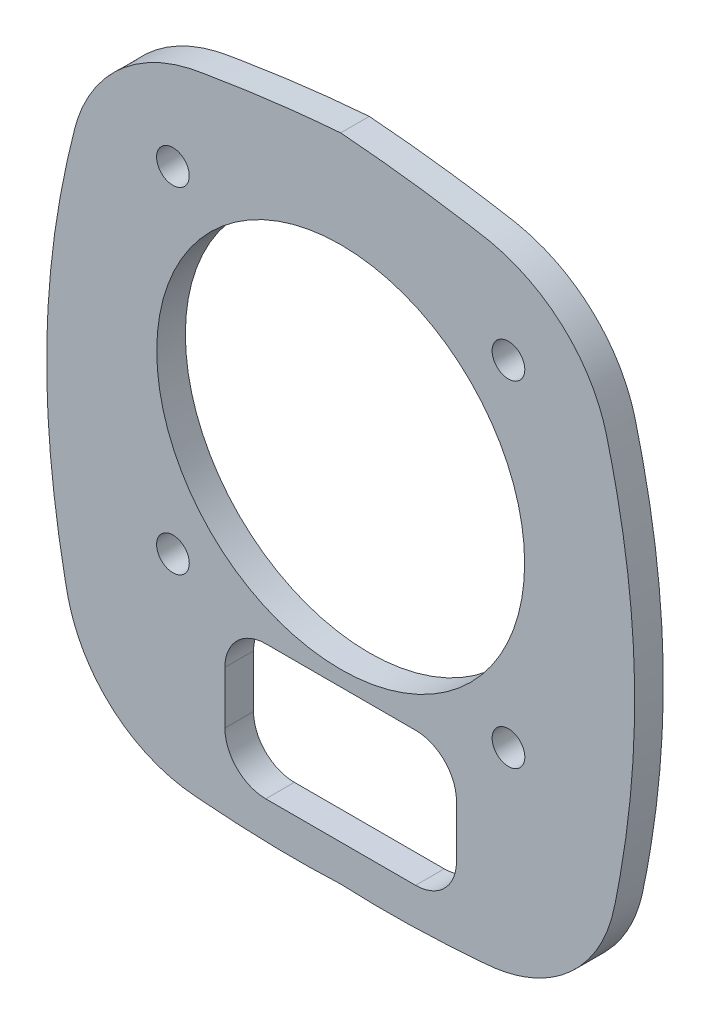
from build123d import *

# Parameters (mm, degrees)
SKETCH_1_R      = 1.6
SKETCH_1_R_2    = 18
EXTRUDE_1_DEPTH = 1.4


with BuildPart() as part:
    # Эскиз1 → Бобышка-Вытянуть1 (new, symmetric)
    with BuildSketch(Plane.XY):
        with BuildLine():
            add(Edge.make_bspline(
                [(0, 131.106222882), (-0.370220785, 131.076347993), (-1.102779578, 131.017234316), (-2.189060224, 130.919624595), (-3.443637711, 130.798467833), (-4.881735459, 130.646269922), (-6.503020503, 130.456312253), (-8.12495085, 130.247392322), (-9.741711108, 130.020630526), (-11.36281695, 129.775036484), (-12.676015392, 129.561961331), (-13.68967903, 129.390078582), (-14.413232864, 129.264584839), (-15.159625099, 129.094362093), (-15.928185443, 128.880405682), (-16.715163254, 128.616368934), (-17.516348702, 128.298628961), (-18.326688606, 127.922941878), (-19.728048414, 127.169724573), (-21.747987535, 125.727575964), (-23.567693799, 123.700004581), (-24.612712681, 122.011346521), (-25.101312847, 121.04901032), (-25.462593655, 120.225148914), (-25.738909462, 119.460763634), (-25.94677143, 118.767454031), (-26.081687876, 118.239687864), (-26.212908569, 117.717370422), (-26.550773375, 116.339124971), (-27.062440519, 114.066420204), (-27.653164131, 110.922560067), (-28.131235228, 107.713696234), (-28.475274231, 104.545836759), (-28.699132748, 101.293497056), (-28.820606115, 96.997365467), (-28.681457815, 92.743441744), (-28.310546102, 88.465729648), (-28.011412762, 86.039840672), (-27.687188607, 83.821524975), (-27.446887043, 82.351713486), (-27.170364704, 80.822297117), (-26.964445801, 79.763919621), (-26.795893016, 78.905610826), (-26.639789871, 78.227638137), (-26.496238435, 77.706670532), (-26.315714678, 77.126427714), (-26.080412167, 76.474242148), (-25.653035676, 75.47125893), (-25.021169521, 74.284763335), (-23.797814677, 72.515816398), (-22.274906789, 70.980648572), (-20.507858139, 69.748039699), (-19.073299489, 68.983497976), (-17.565682132, 68.396534243), (-16.374108839, 68.085794929), (-15.540656532, 67.931878814), (-15.058842612, 67.858658077), (-14.543170425, 67.797527545), (-13.993799753, 67.752137476), (-13.412264546, 67.704717217), (-12.688945313, 67.650229305), (-11.804304984, 67.589091763), (-10.73880925, 67.52411052), (-8.932087435, 67.42921281), (-6.950627599, 67.36001138), (-4.815403254, 67.335396808), (-3.186397421, 67.342670006), (-1.577573114, 67.374694658), (-0.508566905, 67.421110428), (0, 67.443192175)],
                knots=[0, 0, 0, 0, 0.010771191, 0.02131304, 0.031628454, 0.047322767, 0.063249599, 0.078966036, 0.094746057, 0.11059324, 0.126513589, 0.133325198, 0.140410134, 0.147805883, 0.155515432, 0.163537099, 0.171866609, 0.180497955, 0.189423614, 0.217985674, 0.251992716, 0.267592695, 0.275472244, 0.283274722, 0.293667804, 0.299018776, 0.304259573, 0.309463091, 0.314637016, 0.345411575, 0.377006574, 0.407382407, 0.439472665, 0.469388094, 0.50189901, 0.564078892, 0.592670464, 0.626403664, 0.634940925, 0.657684734, 0.669589076, 0.680011587, 0.688953116, 0.694953853, 0.700182096, 0.704619949, 0.712574345, 0.720275767, 0.736225015, 0.751452289, 0.78255157, 0.798227668, 0.813816479, 0.82957521, 0.845040558, 0.849440511, 0.854151769, 0.859170891, 0.864496245, 0.87013637, 0.876091626, 0.885531561, 0.8958518, 0.907047779, 0.937998223, 0.953339227, 0.968970642, 0.985238155, 1, 1, 1, 1], degree=3))
            add(Edge.make_bspline(
                [(0, 67.443192175), (0.249821364, 67.431628062), (0.762662013, 67.40788891), (1.552151885, 67.380688451), (2.38158192, 67.359162124), (3.492443713, 67.340799343), (4.860854811, 67.335584203), (7.017688253, 67.361429059), (9.206266825, 67.439481423), (11.360555129, 67.559242305), (12.742830846, 67.652471284), (13.828642073, 67.738350945), (14.670177097, 67.806690644), (15.433665488, 67.910835289), (16.43715099, 68.097635371), (17.7023193, 68.441566796), (19.19906457, 69.04219543), (20.619754867, 69.817813812), (22.370543972, 71.063544766), (23.879054895, 72.612317775), (25.087984722, 74.395533827), (25.708103716, 75.586617657), (26.125541169, 76.590715807), (26.381172043, 77.319435939), (26.610332418, 78.098259903), (26.771259587, 78.796324954), (26.904003327, 79.460947792), (27.019377268, 80.04101619), (27.141224488, 80.6773507), (27.269461333, 81.369952952), (27.48482909, 82.581967896), (27.69853251, 83.895434571), (28.020991969, 86.109477736), (28.322099842, 88.575755775), (28.688440492, 92.86238598), (28.82169129, 97.132197747), (28.691853506, 101.444329278), (28.461147635, 104.703501922), (28.11041252, 107.874360128), (27.625487332, 111.086050261), (27.027115418, 114.236733399), (26.490376549, 116.600816702), (26.103003987, 118.15804878), (25.921243346, 118.866835156), (25.677595437, 119.639466291), (25.110109967, 121.14785111), (23.832711812, 123.43277094), (21.622994104, 125.838661408), (19.585309988, 127.259620437), (18.176655717, 127.99690654), (17.365078488, 128.362625042), (16.563395265, 128.670990381), (15.776455467, 128.926042141), (15.008483475, 129.131941856), (14.262643492, 129.293613738), (13.540279292, 129.415036674), (12.534500053, 129.585694823), (11.23493113, 129.794831482), (9.103598592, 130.116248501), (6.966209264, 130.402556522), (4.828909424, 130.65214503), (3.228804537, 130.820700086), (1.621804658, 130.97375985), (0.54635647, 131.061598497), (0, 131.106222882)],
                knots=[0, 0, 0, 0, 0.007252899, 0.014888965, 0.022909471, 0.031315438, 0.047109596, 0.062593786, 0.093869192, 0.110611185, 0.125167253, 0.134046281, 0.142201111, 0.14964863, 0.156381348, 0.171795973, 0.187580878, 0.203048579, 0.21862316, 0.249784285, 0.265041537, 0.281007318, 0.288624024, 0.296566116, 0.30339124, 0.312158749, 0.317330326, 0.323047655, 0.329310904, 0.336120154, 0.34347537, 0.365011642, 0.37470932, 0.408363303, 0.437047062, 0.499467311, 0.532105703, 0.562131004, 0.594200646, 0.624600263, 0.656307776, 0.687187957, 0.694889722, 0.702849025, 0.708402608, 0.718376373, 0.749561686, 0.78361641, 0.812211035, 0.821107497, 0.829710036, 0.838011553, 0.846006084, 0.853689891, 0.861061349, 0.86812915, 0.874930843, 0.890648177, 0.906302189, 0.937440768, 0.953185002, 0.968706837, 0.984102235, 1, 1, 1, 1], degree=3))
        make_face()
        with Locations((16.417549031, 120.054494051)):
            Circle(SKETCH_1_R, mode=Mode.SUBTRACT)
        with Locations((0, 103.636945021)):
            Circle(SKETCH_1_R_2, mode=Mode.SUBTRACT)
        with Locations(Location((-16.416766384, 120.054494051, 0), (0, 0, 180))):
            Circle(SKETCH_1_R, mode=Mode.SUBTRACT)
        with Locations((-16.416766384, 87.21939599)):
            Circle(SKETCH_1_R, mode=Mode.SUBTRACT)
        with Locations(Location((16.417549031, 87.21939599, 0), (0, 0, 180))):
            Circle(SKETCH_1_R, mode=Mode.SUBTRACT)
        with BuildLine():
            Line((-7.330882536, 71.002350727), (7.331665183, 71.002350727))
            ThreePointArc((7.331665183, 71.002350727), (10.160092308, 72.173923602), (11.331665183, 75.002350727))
            Line((11.331665183, 75.002350727), (11.331665183, 80.143547066))
            ThreePointArc((11.331665183, 80.143547066), (10.160092308, 82.971974191), (7.331665183, 84.143547066))
            Line((7.331665183, 84.143547066), (-7.330882536, 84.143547066))
            ThreePointArc((-7.330882536, 84.143547066), (-10.15930966, 82.971974191), (-11.330882536, 80.143547066))
            Line((-11.330882536, 80.143547066), (-11.330882536, 75.002350727))
            ThreePointArc((-11.330882536, 75.002350727), (-10.15930966, 72.173923602), (-7.330882536, 71.002350727))
        make_face(mode=Mode.SUBTRACT)
    extrude(amount=EXTRUDE_1_DEPTH, both=True)


solid = part.part
